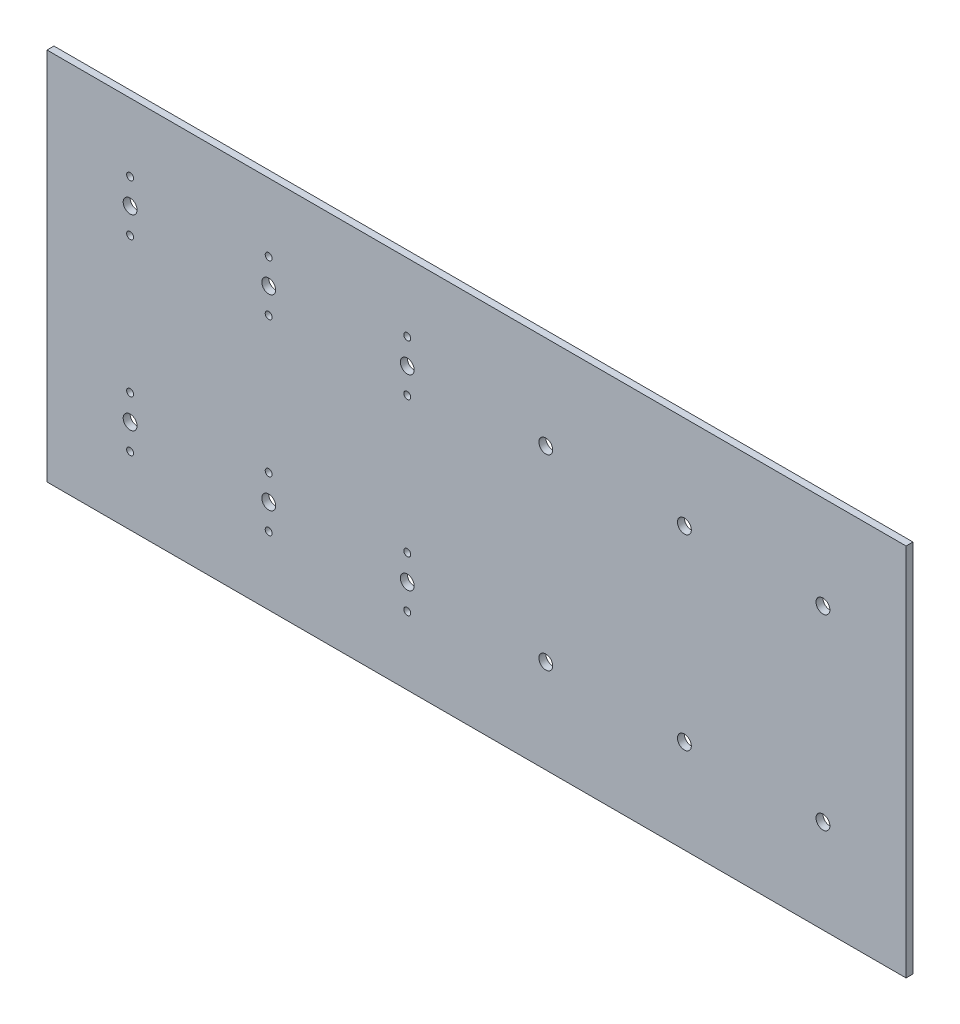
from build123d import *

# Parameters (mm, degrees)
SKETCH_1_W          = 620
SKETCH_1_H          = 270
EXTRUDE_1_DEPTH     = 5
SKETCH_2_R          = 5
SKETCH_2_R_2        = 2.5
CUT_EXTRUDE_1_DEPTH = 664.117636623


with BuildPart() as part:
    # 草图1 → 凸台-拉伸1 (new body)
    with BuildSketch(Plane.XY):
        with Locations((300, -125)):
            Rectangle(SKETCH_1_W, SKETCH_1_H)
    extrude(amount=EXTRUDE_1_DEPTH)

    # 草图2 → 切除-拉伸1 (cut, through all)
    with BuildSketch(Plane(origin=(0, 0, 0), x_dir=(-1, 0, 0), z_dir=(0, 0, -1))):
        with Locations((-50, -192.5)):
            Circle(SKETCH_2_R)
        with Locations((-150, -192.5)):
            Circle(SKETCH_2_R)
        with Locations((-250, -192.5)):
            Circle(SKETCH_2_R)
        with Locations(Location((-350, -192.5, 0), (0, 0, 180))):
            Circle(SKETCH_2_R)
        with Locations(Location((-450, -192.5, 0), (0, 0, 180))):
            Circle(SKETCH_2_R)
        with Locations(Location((-550, -192.5, 0), (0, 0, 180))):
            Circle(SKETCH_2_R)
        with Locations((-550, -57.5)):
            Circle(SKETCH_2_R)
        with Locations((-450, -57.5)):
            Circle(SKETCH_2_R)
        with Locations((-350, -57.5)):
            Circle(SKETCH_2_R)
        with Locations(Location((-250, -57.5, 0), (0, 0, 180))):
            Circle(SKETCH_2_R)
        with Locations(Location((-150, -57.5, 0), (0, 0, 180))):
            Circle(SKETCH_2_R)
        with Locations(Location((-50, -57.5, 0), (0, 0, 180))):
            Circle(SKETCH_2_R)
        with Locations((-50, -75.9)):
            Circle(SKETCH_2_R_2)
        with Locations(Location((-50, -39.1, 0), (0, 0, 180))):
            Circle(SKETCH_2_R_2)
        with Locations((-50, -210.9)):
            Circle(SKETCH_2_R_2)
        with Locations(Location((-50, -174.1, 0), (0, 0, 180))):
            Circle(SKETCH_2_R_2)
        with Locations(Location((-250, -210.9, 0), (0, 0, 180))):
            Circle(SKETCH_2_R_2)
        with Locations((-250, -174.1)):
            Circle(SKETCH_2_R_2)
        with Locations(Location((-250, -75.9, 0), (0, 0, 180))):
            Circle(SKETCH_2_R_2)
        with Locations((-250, -39.1)):
            Circle(SKETCH_2_R_2)
        with Locations(Location((-150, -75.9, 0), (0, 0, 180))):
            Circle(SKETCH_2_R_2)
        with Locations((-150, -39.1)):
            Circle(SKETCH_2_R_2)
        with Locations(Location((-150, -210.9, 0), (0, 0, 180))):
            Circle(SKETCH_2_R_2)
        with Locations((-150, -174.1)):
            Circle(SKETCH_2_R_2)
    extrude(amount=-CUT_EXTRUDE_1_DEPTH, mode=Mode.SUBTRACT)


solid = part.part
